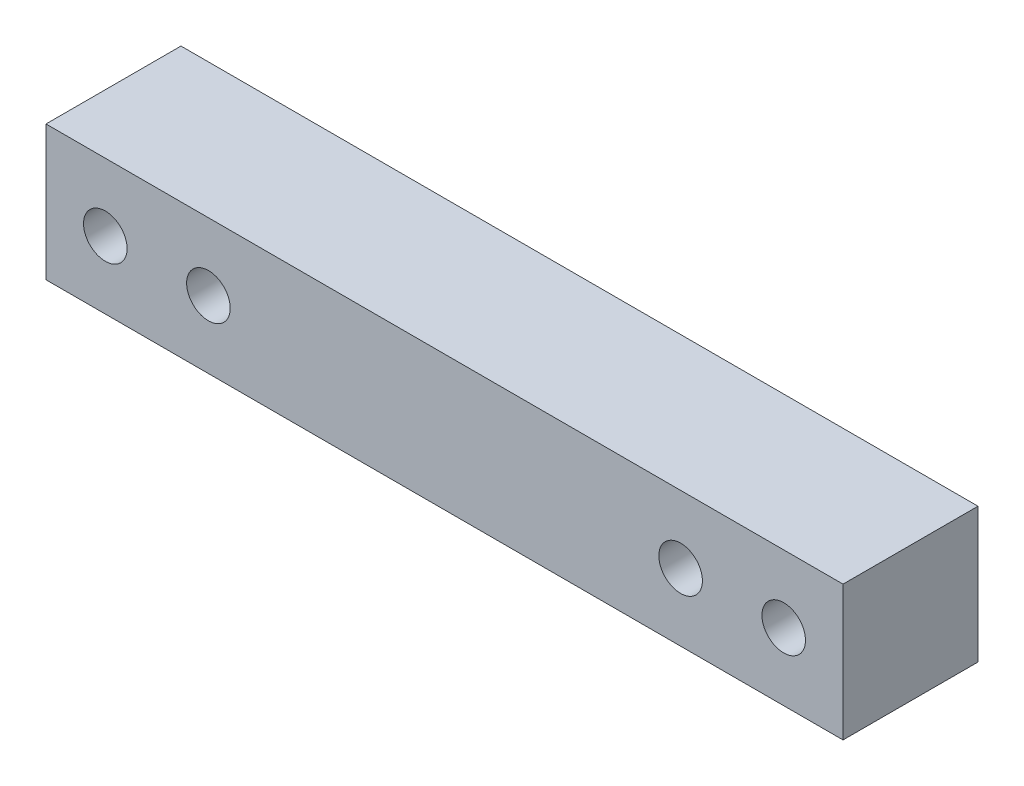
from build123d import *

# Parameters (mm, degrees)
BOSS_EXTRUDE1_DEPTH = 12.7
CUT_EXTRUDE1_DEPTH  = 12.7
BOSS_EXTRUDE3_START = -12.7
SKETCH3_W           = 75
SKETCH3_H           = 12.7
SKETCH3_R           = 2.05
BOSS_EXTRUDE3_DEPTH = 12.7
SKETCH4_R           = 2.05
CUT_EXTRUDE2_DEPTH  = 21.7


with BuildPart() as part:
    # Sketch1 → Boss-Extrude1 (new body)
    with BuildSketch(Plane(origin=(0, 0, 0), x_dir=(1, 0, 0), z_dir=(0, 1, 0))):
        Polygon((-58.57612782, 0), (16.42387218, 0), (16.42387218, 5), (-37.711466165, 5), (-37.711466165, 10), (-58.57612782, 10), align=None)
    extrude(amount=BOSS_EXTRUDE1_DEPTH)

    # Sketch2 → Cut-Extrude1 (cut)
    with BuildSketch(Plane(origin=(0, 0, -10), x_dir=(-1, 0, 0), z_dir=(0, 0, -1))):
        with BuildLine():
            ThreePointArc((41.243796992, 6.35), (43.293796992, 4.3), (45.343796992, 6.35))
            Line((45.343796992, 6.35), (41.243796992, 6.35))
        make_face()
        with BuildLine():
            Line((41.243796992, 6.35), (45.343796992, 6.35))
            ThreePointArc((45.343796992, 6.35), (43.293796992, 8.4), (41.243796992, 6.35))
        make_face()
        with BuildLine():
            ThreePointArc((55.043796992, 6.35), (52.993796992, 8.4), (50.943796992, 6.35))
            Line((50.943796992, 6.35), (55.043796992, 6.35))
        make_face()
        with BuildLine():
            Line((55.043796992, 6.35), (50.943796992, 6.35))
            ThreePointArc((50.943796992, 6.35), (52.993796992, 4.3), (55.043796992, 6.35))
        make_face()
    extrude(amount=-CUT_EXTRUDE1_DEPTH, mode=Mode.SUBTRACT)

    # Sketch3 → Boss-Extrude3 (add)
    with BuildSketch(Plane.XY.offset(BOSS_EXTRUDE3_START)):
        with Locations((-21.07612782, 6.35)):
            Rectangle(SKETCH3_W, SKETCH3_H)
        with Locations(Location((-52.993796992, 6.35, 0), (0, 0, 180))):
            Circle(SKETCH3_R, mode=Mode.SUBTRACT)
        with Locations(Location((-43.293796992, 6.35, 0), (0, 0, 180))):
            Circle(SKETCH3_R, mode=Mode.SUBTRACT)
    extrude(amount=BOSS_EXTRUDE3_DEPTH)

    # Sketch4 → Cut-Extrude2 (cut)
    with BuildSketch(Plane(origin=(0, 0, -12.7), x_dir=(-1, 0, 0), z_dir=(0, 0, -1))):
        with Locations((-10.841541353, 6.35)):
            Circle(SKETCH4_R)
        with Locations((-1.141541353, 6.35)):
            Circle(SKETCH4_R)
    extrude(amount=-CUT_EXTRUDE2_DEPTH, mode=Mode.SUBTRACT)


solid = part.part
